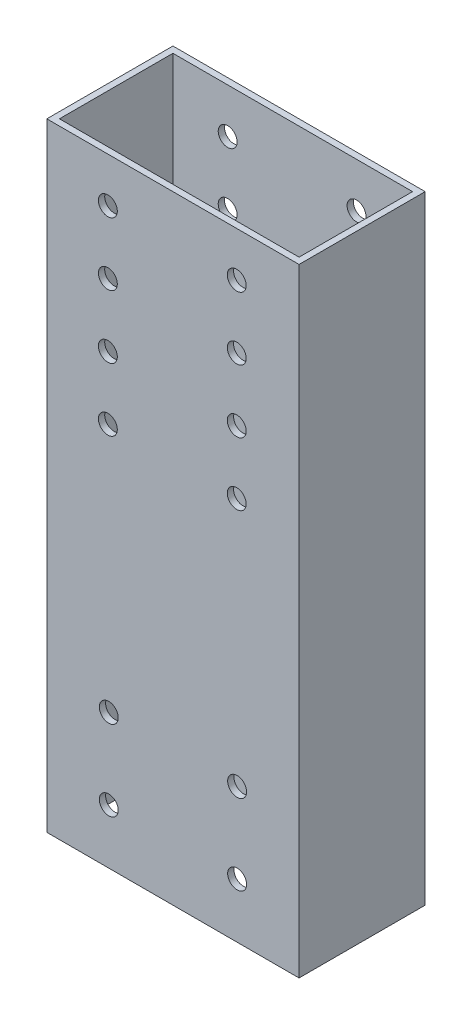
from build123d import *

# Parameters (mm, degrees)
SKETCH_1_W          = 40
SKETCH_1_H          = 20
EXTRUDE_1_DEPTH     = 98
SHELL_1_T           = -1
SKETCH_2_R          = 1.5
CUT_EXTRUDE_1_DEPTH = 23
SKETCH_4_R          = 1.5
CUT_EXTRUDE_2_DEPTH = 48


with BuildPart() as part:
    # 草图1 → 凸台-拉伸1 (new body)
    with BuildSketch(Plane(origin=(0, 0, 0), x_dir=(1, 0, 0), z_dir=(0, 1, 0))):
        Rectangle(SKETCH_1_W, SKETCH_1_H)
    extrude(amount=EXTRUDE_1_DEPTH)

    # 抽壳1
    shell_1_openings = [part.faces().sort_by_distance(p)[0] for p in [
        (0, 0, 0),
        (0, 98, 0),
    ]]
    offset(amount=SHELL_1_T, openings=shell_1_openings, kind=Kind.INTERSECTION)

    # 草图2 → 切除-拉伸1 (cut)
    with BuildSketch(Plane(origin=(0, 0, -10), x_dir=(-1, 0, 0), z_dir=(0, 0, -1))):
        with Locations((-10.180049386, 8.687582917)):
            Circle(SKETCH_2_R)
        with Locations((-10.180049386, 21.401128756)):
            Circle(SKETCH_2_R)
        with Locations((10.180049386, 21.401128756)):
            Circle(SKETCH_2_R)
        with Locations((10.180049386, 8.687582917)):
            Circle(SKETCH_2_R)
    extrude(amount=-CUT_EXTRUDE_1_DEPTH, mode=Mode.SUBTRACT)

    # 草图4 → 切除-拉伸2 (cut)
    with BuildSketch(Plane(origin=(0, 0, -10), x_dir=(-1, 0, 0), z_dir=(0, 0, -1))):
        with Locations((10.321220159, 60.899833626)):
            Circle(SKETCH_4_R)
        with Locations((-10.116242576, 60.899833626)):
            Circle(SKETCH_4_R)
        with Locations((-10.116242576, 70.899833626)):
            Circle(SKETCH_4_R)
        with Locations((10.321220159, 70.899833626)):
            Circle(SKETCH_4_R)
        with Locations((10.321220159, 80.899833626)):
            Circle(SKETCH_4_R)
        with Locations((-10.116242576, 80.899833626)):
            Circle(SKETCH_4_R)
        with Locations((10.321220159, 90.899833626)):
            Circle(SKETCH_4_R)
        with Locations((-10.116242576, 90.899833626)):
            Circle(SKETCH_4_R)
    extrude(amount=-CUT_EXTRUDE_2_DEPTH, mode=Mode.SUBTRACT)


solid = part.part
